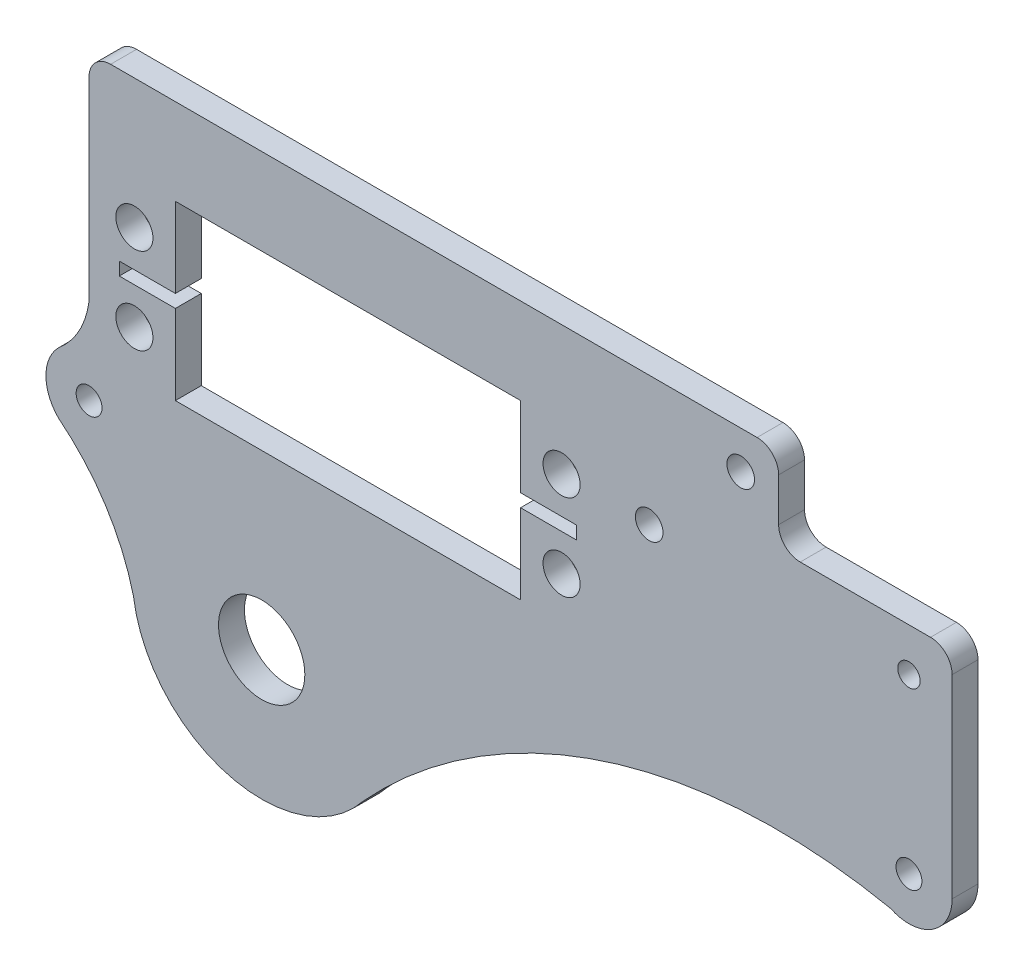
from build123d import *

# Parameters (mm, degrees)
SKETCH_1_R          = 5
SKETCH_1_R_2        = 2.15
EXTRUDE_1_DEPTH     = 3
SKETCH_2_R          = 1.5
CUT_EXTRUDE_1_DEPTH = 117.657618697
CUT_EXTRUDE_3_DEPTH = 117.657618697
SKETCH_5_R          = 1.5
EXTRUDE_3_DEPTH     = 3
CUT_EXTRUDE_4_DEPTH = 117.657618697
SKETCH_7_R          = 1.6
CUT_EXTRUDE_6_DEPTH = 117.657618697
SKETCH_8_W          = 53
SKETCH_8_H          = 1.5
CUT_EXTRUDE_7_DEPTH = 117.657618697
SKETCH_9_W          = 79.9
SKETCH_9_H          = 10
SKETCH_9_R          = 1.6
EXTRUDE_4_DEPTH     = 3
FILLET_1_R          = 2.5


with BuildPart() as part:
    # ｽｹｯﾁ1 → ﾎﾞｽ - 押し出し1 (new body)
    with BuildSketch(Plane.XY):
        Polygon((10, 60), (0, 60), (0, 0), (100, 0), (100, 50), (100, 60), (50, 60), (50, 40), (10, 40), align=None)
        with Locations((20, 20)):
            Circle(SKETCH_1_R, mode=Mode.SUBTRACT)
        with Locations((5.25, 45)):
            Circle(SKETCH_1_R_2, mode=Mode.SUBTRACT)
        with Locations((5.25, 55)):
            Circle(SKETCH_1_R_2, mode=Mode.SUBTRACT)
        with Locations((54.75, 45)):
            Circle(SKETCH_1_R_2, mode=Mode.SUBTRACT)
        with Locations((54.75, 55)):
            Circle(SKETCH_1_R_2, mode=Mode.SUBTRACT)
    extrude(amount=EXTRUDE_1_DEPTH)

    # ｽｹｯﾁ2 → ｶｯﾄ - 押し出し1 (cut, through all)
    with BuildSketch(Plane.XY.offset(3)):
        with Locations((95, 35)):
            Circle(SKETCH_2_R)
    extrude(amount=-CUT_EXTRUDE_1_DEPTH, mode=Mode.SUBTRACT)

    # ｽｹｯﾁ4 → ｶｯﾄ - 押し出し3 (cut, through all)
    with BuildSketch(Plane.XY.offset(3)):
        with BuildLine():
            ThreePointArc((30.606601718, 9.393398282), (11.666446505, 7.527955815), (6.141807012, 25.740251485))
            ThreePointArc((6.141807012, 25.740251485), (5.992593584, 34.011854082), (1.731818145, 41.103219734))
            ThreePointArc((1.731818145, 41.103219734), (1.633577382, 41.194216579), (1.537689399, 41.287689399))
            ThreePointArc((1.537689399, 41.287689399), (0.399632454, 42.99091198), (0, 45))
            Line((0, 45), (0, 0))
            Line((0, 0), (100, 0))
            Line((100, 0), (100, 35))
            ThreePointArc((100, 35), (98.535533906, 31.464466094), (95, 30))
            ThreePointArc((95, 30), (93.906844507, 30.120962075), (92.866581158, 30.477995572))
            ThreePointArc((92.866581158, 30.477995572), (59.698938801, 28.658859349), (31.76111788, 10.689999666))
            ThreePointArc((31.76111788, 10.689999666), (31.202634234, 10.024981894), (30.606601718, 9.393398282))
        make_face()
    extrude(amount=-CUT_EXTRUDE_3_DEPTH, mode=Mode.SUBTRACT)

    # ｽｹｯﾁ5 → ﾎﾞｽ - 押し出し3 (add, through all)
    # profile 1 of 2: a face of its own
    with BuildSketch(Plane.XY.offset(3)):
        with BuildLine():
            ThreePointArc((-3.074339462, 38.943150628), (-3.301799792, 38.735793058), (-3.535533906, 38.535533906))
            ThreePointArc((-3.535533906, 38.535533906), (-5, 35), (-3.535533906, 31.464466094))
            ThreePointArc((-3.535533906, 31.464466094), (-3.171489153, 31.168816808), (-2.813054288, 30.866390733))
            ThreePointArc((-2.813054288, 30.866390733), (2.338239569, 30.580425844), (5, 35))
            ThreePointArc((5, 35), (2.194117441, 39.492866419), (-3.074339462, 38.943150628))
        make_face()
        with Locations((0, 35)):
            Circle(SKETCH_5_R, mode=Mode.SUBTRACT)
    # profile 2 of 2: a face of its own
    with BuildSketch(Plane.XY.offset(3)):
        with BuildLine():
            ThreePointArc((0, 45), (-1.007160055, 41.702552665), (-3.074339462, 38.943150628))
            ThreePointArc((-3.074339462, 38.943150628), (2.194117441, 39.492866419), (5, 35))
            ThreePointArc((5, 35), (2.338239569, 30.580425844), (-2.813054288, 30.866390733))
            ThreePointArc((-2.813054288, 30.866390733), (2.156646174, 25.048507639), (5.133931253, 18))
            ThreePointArc((5.133931253, 18), (5.125569714, 21.936833416), (6.141807012, 25.740251485))
            ThreePointArc((6.141807012, 25.740251485), (5.992593584, 34.011854082), (1.731818145, 41.103219734))
            ThreePointArc((1.731818145, 41.103219734), (0.4524509, 42.867859613), (0, 45))
        make_face()
    extrude(amount=-EXTRUDE_3_DEPTH)

    # ｽｹｯﾁ6 → ｶｯﾄ - 押し出し4 (cut, through all)
    with BuildSketch(Plane.XY.offset(3)):
        with BuildLine():
            ThreePointArc((96.3, 55), (95.919238816, 55.919238816), (95, 56.3))
            Line((95, 56.3), (95, 53.7))
            ThreePointArc((95, 53.7), (95.919238816, 54.080761184), (96.3, 55))
        make_face()
        with BuildLine():
            Line((95, 53.7), (95, 56.3))
            ThreePointArc((95, 56.3), (93.7, 55), (95, 53.7))
        make_face()
    extrude(amount=-CUT_EXTRUDE_4_DEPTH, mode=Mode.SUBTRACT)

    # ｽｹｯﾁ7 → ｶｯﾄ - 押し出し6 (cut, through all)
    with BuildSketch(Plane.XY.offset(3)):
        with Locations((64.9, 55)):
            Circle(SKETCH_7_R)
    extrude(amount=-CUT_EXTRUDE_6_DEPTH, mode=Mode.SUBTRACT)

    # ｽｹｯﾁ8 → ｶｯﾄ - 押し出し7 (cut, through all)
    with BuildSketch(Plane.XY.offset(3)):
        with Locations((30, 50)):
            Rectangle(SKETCH_8_W, SKETCH_8_H)
    extrude(amount=-CUT_EXTRUDE_7_DEPTH, mode=Mode.SUBTRACT)

    # ｽｹｯﾁ9 → ﾎﾞｽ - 押し出し4 (add, through all)
    with BuildSketch(Plane.XY.offset(3)):
        with Locations((39.95, 65)):
            Rectangle(SKETCH_9_W, SKETCH_9_H)
        with Locations((75.506601718, 65.606601718)):
            Circle(SKETCH_9_R, mode=Mode.SUBTRACT)
    extrude(amount=-EXTRUDE_4_DEPTH)

    # ﾌｨﾚｯﾄ1
    fillet_1_edges = [part.edges().sort_by_distance(p)[0] for p in [
        (0, 70, 1.5),
        (79.9, 70, 1.5),
        (79.9, 60, 1.5),
        (100, 60, 1.5),
    ]]
    fillet(fillet_1_edges, radius=FILLET_1_R)


solid = part.part
